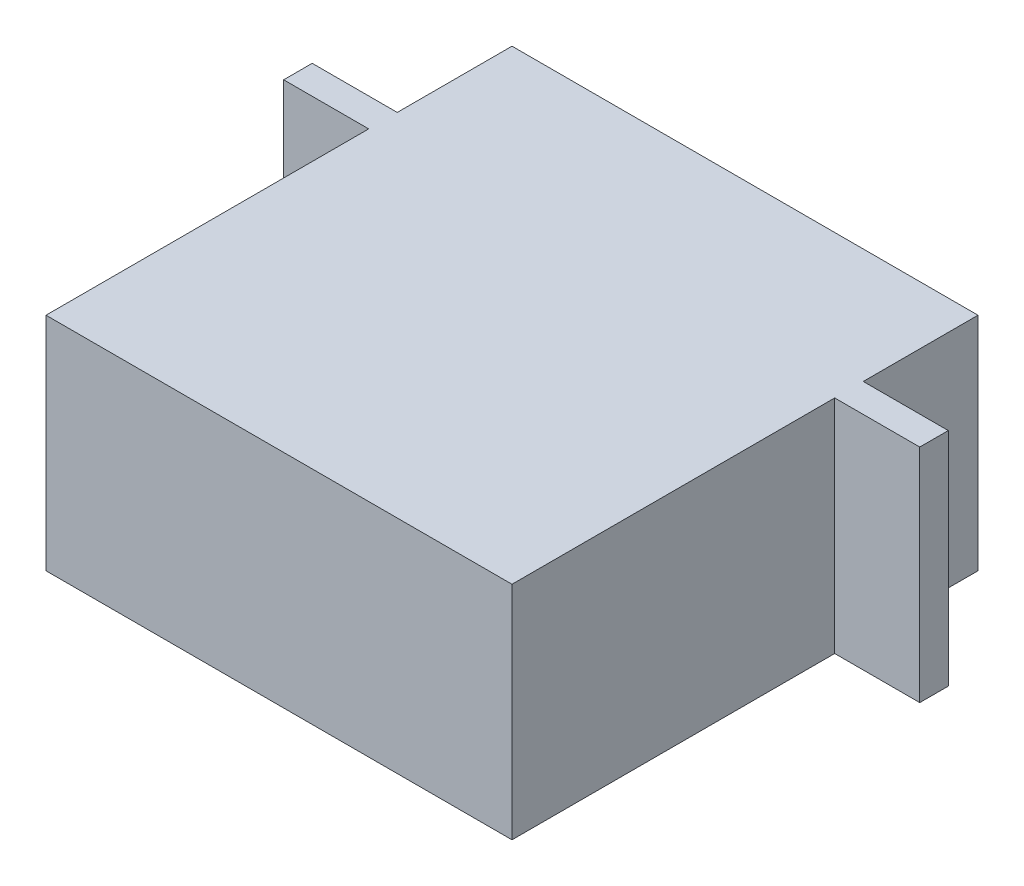
from build123d import *

# Parameters (mm, degrees)
SKETCH_1_W      = 40
SKETCH_1_H      = 40
EXTRUDE_1_DEPTH = 19
SKETCH_2_R      = 3
EXTRUDE_2_DEPTH = 4
SKETCH_3_W      = 2.45
SKETCH_3_H      = 19
EXTRUDE_3_DEPTH = 7.3
SKETCH_5_W      = 2.45
SKETCH_5_H      = 19
EXTRUDE_4_DEPTH = 7.3


with BuildPart() as part:
    # Эскиз1 → Бобышка-Вытянуть1 (new body)
    with BuildSketch(Plane(origin=(0, 0, 0), x_dir=(1, 0, 0), z_dir=(0, 1, 0))):
        Rectangle(SKETCH_1_W, SKETCH_1_H)
    extrude(amount=EXTRUDE_1_DEPTH)

    # Эскиз2 → Бобышка-Вытянуть2 (add)
    with BuildSketch(Plane(origin=(0, 0, -20), x_dir=(-1, 0, 0), z_dir=(0, 0, -1))):
        with Locations(Location((-11, 10, 0), (0, 0, 180))):
            Circle(SKETCH_2_R)
    extrude(amount=EXTRUDE_2_DEPTH)

    # Эскиз3 → Бобышка-Вытянуть3 (add)
    with BuildSketch(Plane(origin=(20, 0, 0), x_dir=(0, 0, -1), z_dir=(1, 0, 0))):
        with Locations((8.925, 9.5)):
            Rectangle(SKETCH_3_W, SKETCH_3_H)
    extrude(amount=EXTRUDE_3_DEPTH)

    # Эскиз5 → Бобышка-Вытянуть4 (add)
    with BuildSketch(Plane.ZY.offset(20)):
        with Locations((-8.925, 9.5)):
            Rectangle(SKETCH_5_W, SKETCH_5_H)
    extrude(amount=EXTRUDE_4_DEPTH)


solid = part.part
